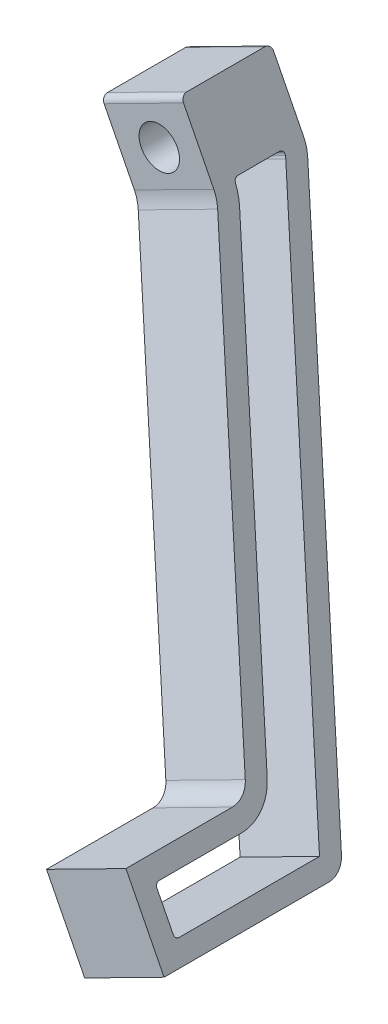
from build123d import *

# Parameters (mm, degrees)
BOSS_EXTRUDE1_DEPTH     = 11.1125
F_3_8_CLEARANCE_HOLE1_D = 10.0838
FILLET1_R               = 10
FILLET2_R               = 5
FILLET3_R               = 1.5
CUT_EXTRUDE1_REACH      = 1431.512
FILLET4_R               = 1


with BuildPart() as part:
    # Sketch4 → Boss-Extrude1 (new, symmetric)
    with BuildSketch(Plane(origin=(839.854692927, 426.912410879, 0), x_dir=(0, 0, -1), z_dir=(0.89140236631763, 0.4532127770962882, 0))):
        Polygon((-1293.587379373, 459.074586593), (-1293.587379373, 480.074586593), (-1263.587379373, 480.074586593), (-1225.891521519, 579.235261263), (-1225.891521519, 599.235261263), (-1203.425314933, 599.235261263), (-1203.425314933, 579.235261263), (-1249.104307407, 459.074586593), align=None)
    extrude(amount=BOSS_EXTRUDE1_DEPTH, both=True)

    # 3/8 Clearance Hole1 (through all)
    with Locations(Plane(origin=(0, 0, 1203.425314933), x_dir=(-1, 0, 0), z_dir=(0, 0, -1))):
        with Locations((-572.805743807, 952.158117087)):
            Hole(F_3_8_CLEARANCE_HOLE1_D / 2)

    # Fillet1
    fillet1_edges = [part.edges().sort_by_distance(p)[0] for p in [
        (577.337871578, 943.244093424, 1225.891521519),
        (577.337871578, 943.244093424, 1203.425314933),
    ]]
    fillet(fillet1_edges, radius=FILLET1_R)

    # Fillet2
    fillet2_edges = [part.edges().sort_by_distance(p)[0] for p in [
        (631.796224642, 836.132583685, 1249.104307407),
        (622.278756323, 854.852033377, 1263.587379373),
    ]]
    fillet(fillet2_edges, radius=FILLET2_R)

    # Fillet3
    fillet3_edges = [part.edges().sort_by_distance(p)[0] for p in [
        (568.273616036, 961.07214075, 1203.425314933),
        (568.273616036, 961.07214075, 1225.891521519),
    ]]
    fillet(fillet3_edges, radius=FILLET3_R)

    # Sketch9 → Cut-Extrude1 (cut, up to next)
    with BuildSketch(Plane(origin=(849.723172799, 432.02196164, 0), x_dir=(0, 0, -1), z_dir=(0.8914023663176289, 0.4532127770962904, 1.344287086354073e-15)), mode=Mode.PRIVATE) as cut_extrude1_sk1:
        with BuildLine():
            Line((-1220.891521519, 580.989746958), (-1208.425314933, 580.989746958))
            ThreePointArc((-1208.425314933, 580.989746958), (-1208.507569969, 580.086539083), (-1208.751628719, 579.213048567))
            Line((-1208.751628719, 579.213048567), (-1252.552657875, 463.992442123))
            Line((-1252.552657875, 463.992442123), (-1288.587379373, 463.992442123))
            Line((-1288.587379373, 463.992442123), (-1288.587379373, 474.992442123))
            Line((-1288.587379373, 474.992442123), (-1267.035729841, 474.992442123))
            ThreePointArc((-1267.035729841, 474.992442123), (-1261.358317042, 476.760371671), (-1257.688357413, 481.43904534))
            Line((-1257.688357413, 481.43904534), (-1221.870462877, 575.659651784))
            ThreePointArc((-1221.870462877, 575.659651784), (-1221.138286626, 578.280123334), (-1220.891521519, 580.989746958))
        make_face()
    cut_extrude1_tool1 = extrude(cut_extrude1_sk1.sketch, amount=-CUT_EXTRUDE1_REACH, mode=Mode.PRIVATE) & part.part
    add(cut_extrude1_tool1.solids().sort_by_distance((617.145834, 889.467119, 1243.085905))[0], mode=Mode.SUBTRACT)

    # Fillet4
    fillet4_edges = [part.edges().sort_by_distance(p)[0] for p in [
        (576.50548732, 944.8812699, 1208.425314933),
        (576.50548732, 944.8812699, 1220.891521519),
        (629.530160757, 840.589595516, 1288.587379373),
        (624.544820209, 850.395021546, 1288.587379373),
    ]]
    fillet(fillet4_edges, radius=FILLET4_R)


solid = part.part
